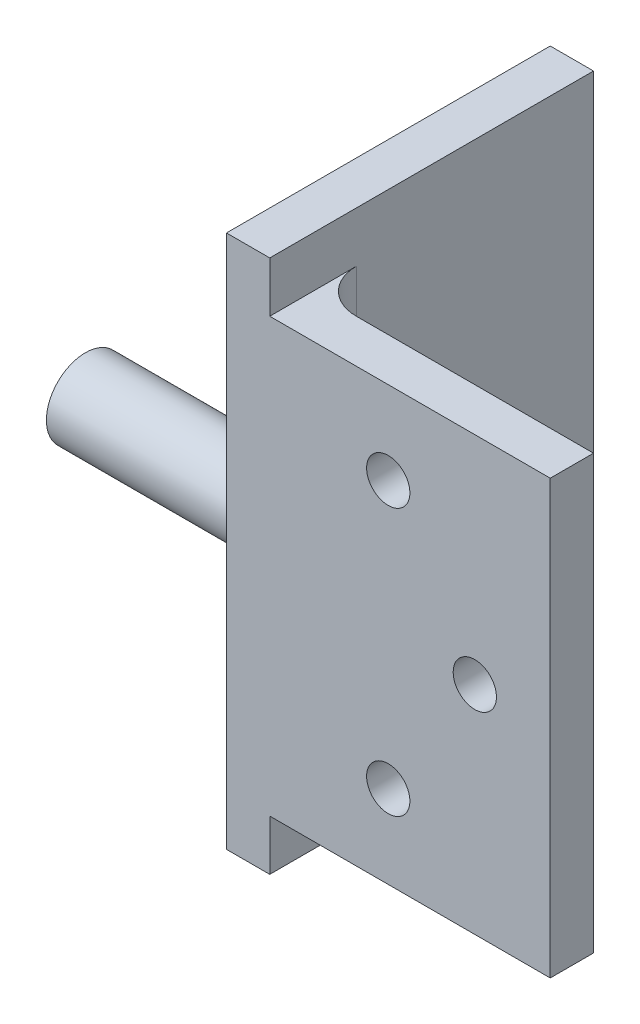
from build123d import *

# Parameters (mm, degrees)
BOSS_EXTRUDE1_DEPTH = 37
FILLET1_R           = 3
SKETCH2_R           = 1.5
SKETCH2_W           = 19.44
SKETCH2_H           = 3.5
CUT_EXTRUDE1_DEPTH  = 49.745330033
SKETCH3_R           = 2.7
BOSS_EXTRUDE2_DEPTH = 21


with BuildPart() as part:
    # Sketch1 → Boss-Extrude1 (new body)
    with BuildSketch(Plane(origin=(0, 0, 0), x_dir=(1, 0, 0), z_dir=(0, 1, 0))):
        Polygon((0, 0), (22.44, 0), (22.44, 3), (3, 3), (3, 22.44), (0, 22.44), align=None)
    extrude(amount=BOSS_EXTRUDE1_DEPTH)

    # Fillet1
    fillet1_edges = [part.edges().sort_by_distance(p)[0] for p in [
        (3, 18.5, -3),
    ]]
    fillet(fillet1_edges, radius=FILLET1_R)

    # Sketch2 → Cut-Extrude1 (cut, through all)
    with BuildSketch(Plane(origin=(0, 0, -22.44), x_dir=(-1, 0, 0), z_dir=(0, 0, -1))):
        with Locations((-11.212785563, 27.75)):
            Circle(SKETCH2_R)
        with Locations((-17.212785563, 18.5)):
            Circle(SKETCH2_R)
        with Locations((-11.212785563, 9.25)):
            Circle(SKETCH2_R)
        with Locations((-12.72, 1.75)):
            Rectangle(SKETCH2_W, SKETCH2_H)
        with Locations((-12.72, 35.25)):
            Rectangle(SKETCH2_W, SKETCH2_H)
    extrude(amount=-CUT_EXTRUDE1_DEPTH, mode=Mode.SUBTRACT)

    # Sketch3 → Boss-Extrude2 (add)
    with BuildSketch(Plane.ZY):
        with Locations(Location((-11.22, 11, 0), (0, 0, 180))):
            Circle(SKETCH3_R)
    extrude(amount=BOSS_EXTRUDE2_DEPTH)


solid = part.part
